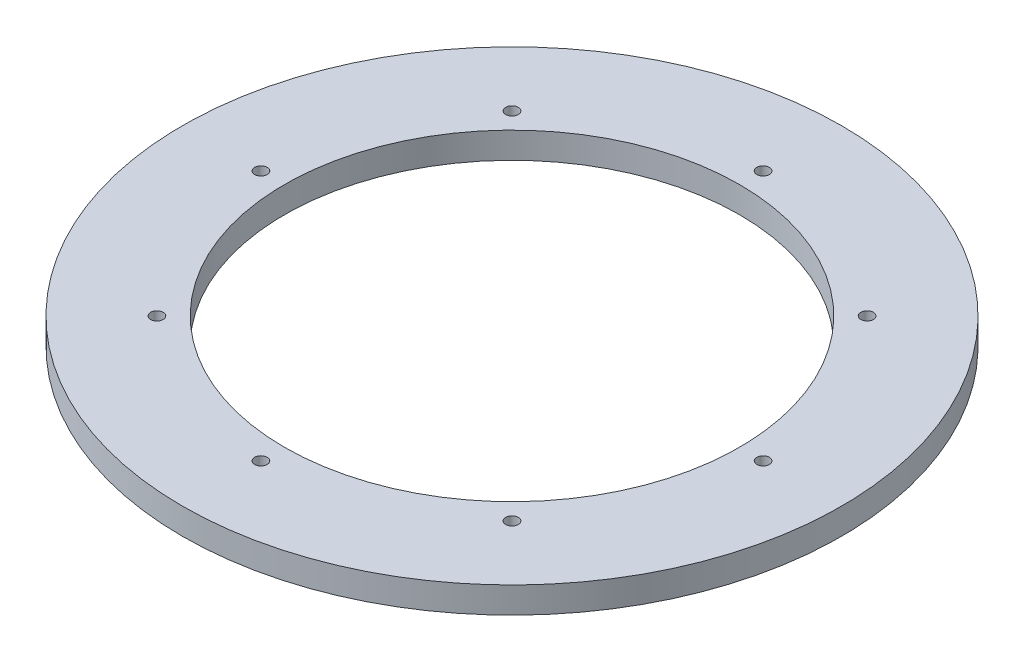
from build123d import *

# Parameters (mm, degrees)
SKETCH1_R           = 315
SKETCH1_R_2         = 217.5
SKETCH1_R_3         = 6
BOSS_EXTRUDE1_DEPTH = 12.5


with BuildPart() as part:
    # Sketch1 → Boss-Extrude1 (new, symmetric)
    with BuildSketch(Plane(origin=(0, 0, 0), x_dir=(1, 0, 0), z_dir=(0, 1, 0))):
        with Locations(Location((0, 0, 0), (0, 0, 270))):
            Circle(SKETCH1_R)
        with Locations(Location((0, 0, 0), (0, 0, 270))):
            Circle(SKETCH1_R_2, mode=Mode.SUBTRACT)
        with Locations(Location((0, 240, 0), (0, 0, 270))):
            Circle(SKETCH1_R_3, mode=Mode.SUBTRACT)
        with Locations(Location((169.705627485, 169.705627485, 0), (0, 0, 270))):
            Circle(SKETCH1_R_3, mode=Mode.SUBTRACT)
        with Locations(Location((240, 0, 0), (0, 0, 270))):
            Circle(SKETCH1_R_3, mode=Mode.SUBTRACT)
        with Locations(Location((169.705627485, -169.705627485, 0), (0, 0, 270))):
            Circle(SKETCH1_R_3, mode=Mode.SUBTRACT)
        with Locations(Location((0, -240, 0), (0, 0, 270))):
            Circle(SKETCH1_R_3, mode=Mode.SUBTRACT)
        with Locations(Location((-169.705627485, -169.705627485, 0), (0, 0, 270))):
            Circle(SKETCH1_R_3, mode=Mode.SUBTRACT)
        with Locations(Location((-240, 0, 0), (0, 0, 270))):
            Circle(SKETCH1_R_3, mode=Mode.SUBTRACT)
        with Locations(Location((-169.705627485, 169.705627485, 0), (0, 0, 270))):
            Circle(SKETCH1_R_3, mode=Mode.SUBTRACT)
    extrude(amount=BOSS_EXTRUDE1_DEPTH, both=True)


solid = part.part
